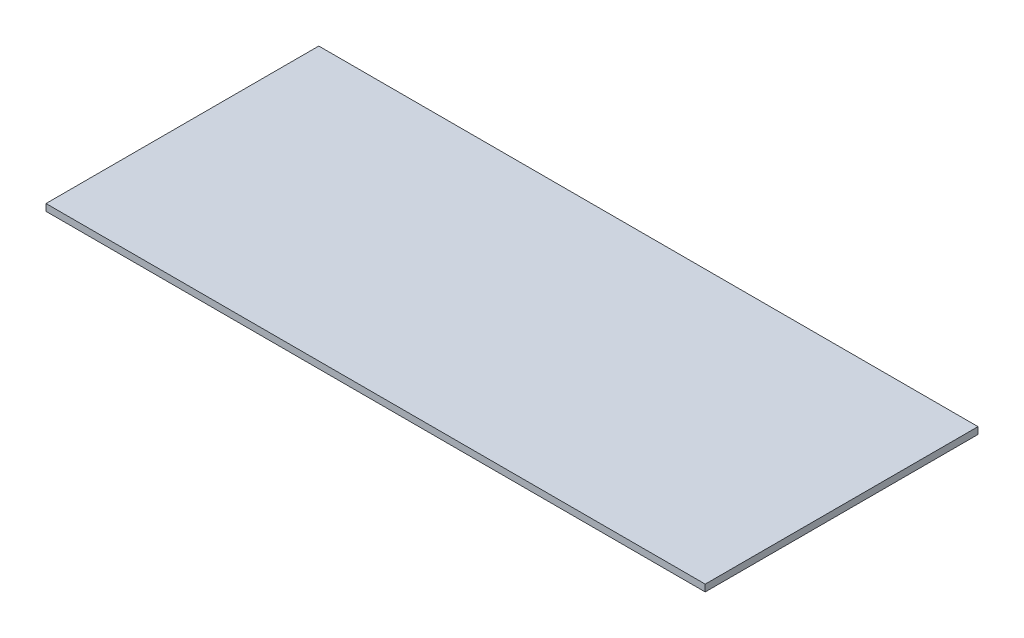
from build123d import *

# Parameters (mm, degrees)
SKETCH1_W           = 290
SKETCH1_H           = 120
BOSS_EXTRUDE1_DEPTH = 3


with BuildPart() as part:
    # Sketch1 → Boss-Extrude1 (new body)
    with BuildSketch(Plane(origin=(0, 0, 0), x_dir=(1, 0, 0), z_dir=(0, 1, 0))):
        with Locations((145, 60)):
            Rectangle(SKETCH1_W, SKETCH1_H)
    extrude(amount=BOSS_EXTRUDE1_DEPTH)


solid = part.part
